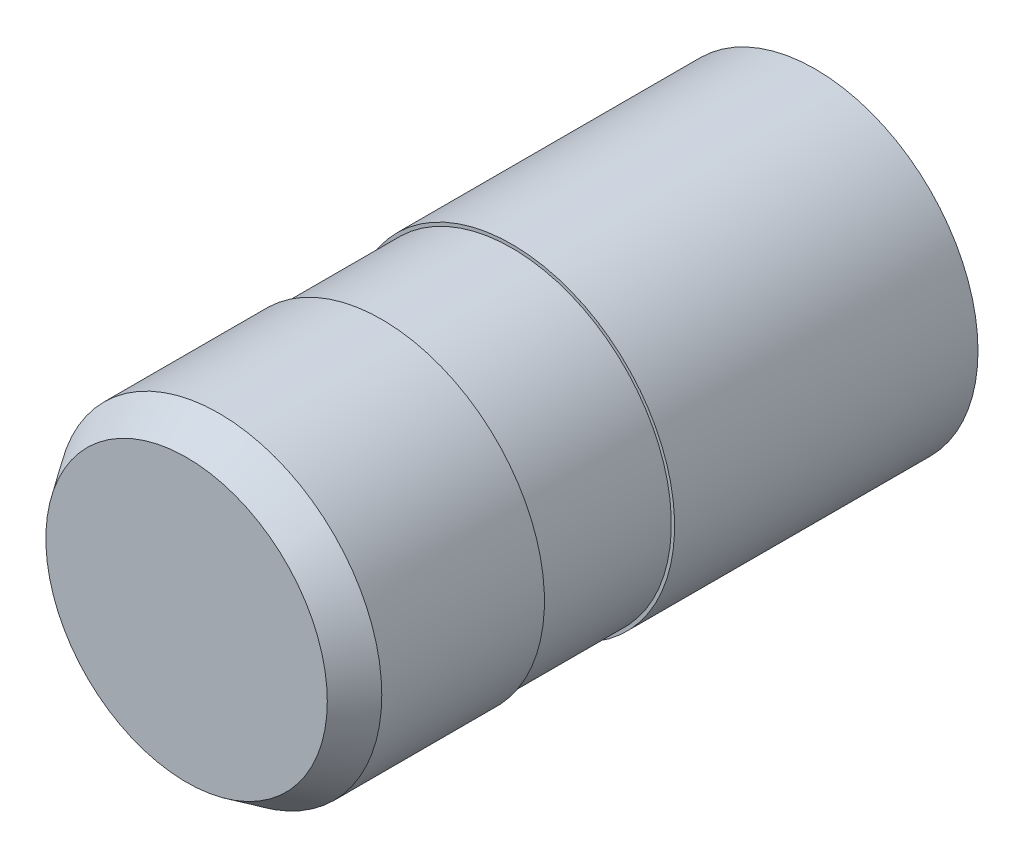
from build123d import *
from OCP.BRepFilletAPI import BRepFilletAPI_MakeChamfer

# Parameters (mm, degrees)
SKETCH_1_R          = 25
EXTRUDE_1_DEPTH     = 50
CHAMFER_1_SIZE      = 5
CHAMFER_1_SIZE2     = 3.372542584
CUT_EXTRUDE_START   = -20
SKETCH_2_R          = 25
SKETCH_2_R_2        = 24.5
CUT_EXTRUDE_1_DEPTH = 20


with BuildPart() as part:
    # 草图1 → 凸台-拉伸1 (new, symmetric)
    with BuildSketch(Plane.XY):
        Circle(SKETCH_1_R)
    extrude(amount=EXTRUDE_1_DEPTH, both=True)

    # 倒角1: one chamfer whose edges measure the first distance from different faces: ONE call of the kernel's chamfer builder (chamfer() names one face for all edges)
    chamfer_1_edges_1 = [part.edges().sort_by_distance(p)[0] for p in [
        (-25, 0, -50),
    ]]
    chamfer_1_side_1 = [part.faces().sort_by_distance(p)[0] for p in [
        (0, 0, -50),
    ]]
    chamfer_1_edges_2 = [part.edges().sort_by_distance(p)[0] for p in [
        (-25, 0, 50),
    ]]
    chamfer_1_side_2 = [part.faces().sort_by_distance(p)[0] for p in [
        (-25, 0, 0),
    ]]
    chamfer_1 = BRepFilletAPI_MakeChamfer(part.part.solid().wrapped)
    for e in chamfer_1_edges_1:
        chamfer_1.Add(CHAMFER_1_SIZE, CHAMFER_1_SIZE2, e.wrapped, chamfer_1_side_1[0].wrapped)  # the first distance lies on this face
    for e in chamfer_1_edges_2:
        chamfer_1.Add(CHAMFER_1_SIZE, CHAMFER_1_SIZE2, e.wrapped, chamfer_1_side_2[0].wrapped)  # the first distance lies on this face
    add(Compound.cast(chamfer_1.Shape()), mode=Mode.REPLACE)

    # 草图2 → 切除-拉伸1 (cut)
    with BuildSketch(Plane(origin=(0, 0, 0), x_dir=(-1, 0, 0), z_dir=(0, 0, -1)).offset(CUT_EXTRUDE_START)):
        Circle(SKETCH_2_R)
        Circle(SKETCH_2_R_2, mode=Mode.SUBTRACT)
    extrude(amount=CUT_EXTRUDE_1_DEPTH, mode=Mode.SUBTRACT)


solid = part.part
